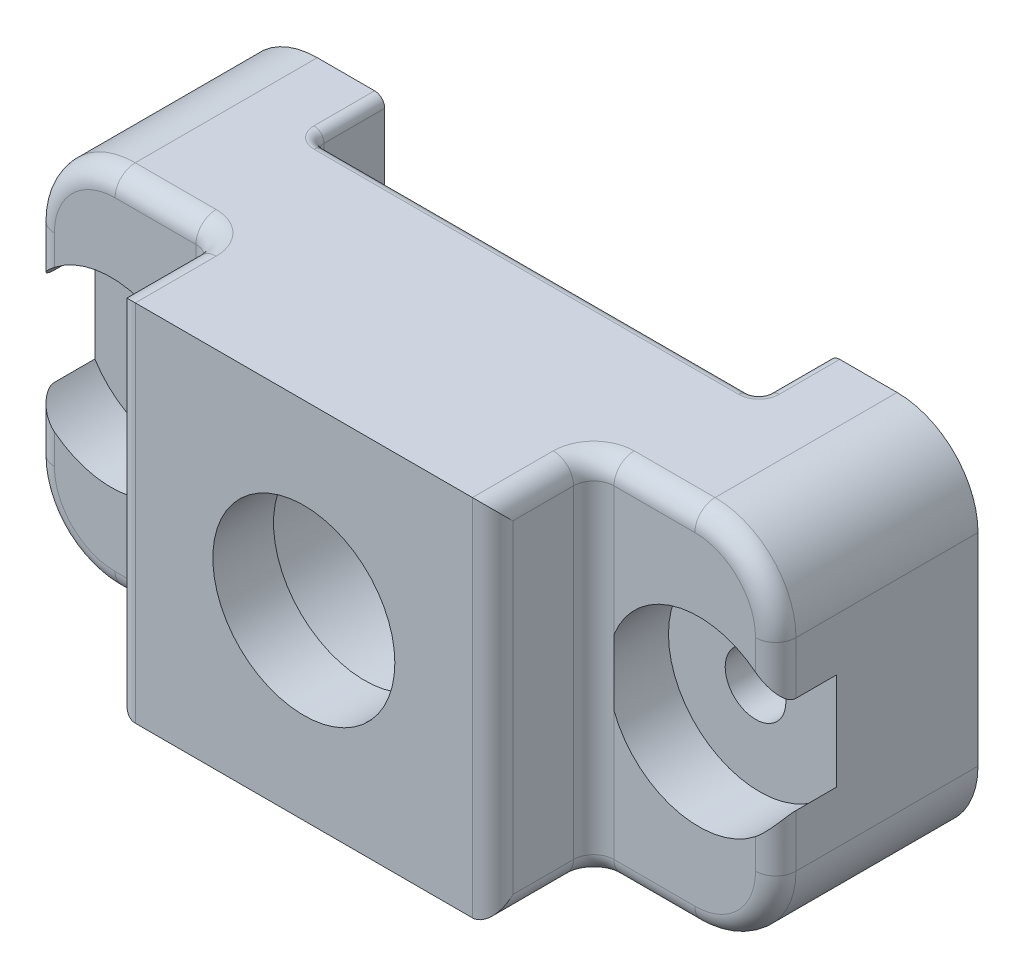
from build123d import *

# Parameters (mm, degrees)
SKETCH1_R            = 5.5
SKETCH1_R_2          = 1.5
BOSS_EXTRUDE1_DEPTH  = 15
SKETCH3_W            = 9.999397818
SKETCH3_H            = 22.225224056
CUT_EXTRUDE1_DEPTH   = 5
FILLET1_R            = 1
FILLET1_OF_MIRROR1_R = 1
SKETCH4_R            = 7.5
BOSS_EXTRUDE2_DEPTH  = 3
SKETCH5_W            = 22
SKETCH5_H            = 7
CUT_EXTRUDE2_DEPTH   = 30.75172255
SKETCH6_R            = 4.5
CUT_EXTRUDE3_DEPTH   = 26.34097462
SKETCH7_R            = 4.5
CUT_EXTRUDE8_DEPTH   = 3
FILLET3_R            = 0.5
FILLET2_R            = 0.5


with BuildPart() as part:
    # Sketch1 → Boss-Extrude1 (new body)
    with BuildSketch(Plane.XY):
        with BuildLine():
            Line((-14.334802826, 9), (14.334802826, 9))
            ThreePointArc((14.334802826, 9), (17.163229951, 7.828427125), (18.334802826, 5))
            Line((18.334802826, 5), (18.334802826, -5))
            ThreePointArc((18.334802826, -5), (17.163229951, -7.828427125), (14.334802826, -9))
            Line((14.334802826, -9), (-14.334802826, -9))
            ThreePointArc((-14.334802826, -9), (-17.163229951, -7.828427125), (-18.334802826, -5))
            Line((-18.334802826, -5), (-18.334802826, 5))
            ThreePointArc((-18.334802826, 5), (-17.163229951, 7.828427125), (-14.334802826, 9))
        make_face()
        Circle(SKETCH1_R, mode=Mode.SUBTRACT)
        with Locations((-14.334802826, 0)):
            Circle(SKETCH1_R_2, mode=Mode.SUBTRACT)
        with Locations(Location((14.334802826, 0, 0), (0, 0, 180))):
            Circle(SKETCH1_R_2, mode=Mode.SUBTRACT)
    extrude(amount=BOSS_EXTRUDE1_DEPTH)

    # Sketch3 → Cut-Extrude1 (cut)
    with BuildSketch(Plane.XY.offset(15)):
        with Locations((-14.334501735, -0.429661625)):
            Rectangle(SKETCH3_W, SKETCH3_H)
    cut_extrude1 = extrude(amount=-CUT_EXTRUDE1_DEPTH, mode=Mode.SUBTRACT)

    # Fillet1
    fillet1_edges = [part.edges().sort_by_distance(p)[0] for p in [
        (-9.334802826, -9, 12.5),
        (-9.334802826, 0, 10),
        (-9.334802826, 9, 12.5),
        (-17.163229951, 7.828427125, 10),
        (-11.834802826, 9, 10),
        (-11.834802826, -9, 10),
        (-17.163229951, -7.828427125, 10),
        (-18.334802826, 0, 10),
        (-9.334802826, 0, 15),
    ]]
    fillet(fillet1_edges, radius=FILLET1_R)

    # Mirror1: Cut-Extrude1 across plane
    add(cut_extrude1.mirror(Plane(origin=(0, 0, 0), x_dir=(0, 0, 1), z_dir=(1, 0, 0))), mode=Mode.SUBTRACT)

    # Fillet1 of Mirror1
    fillet1_of_mirror1_edges = [part.edges().sort_by_distance(p)[0] for p in [
        (9.334802826, -9, 12.5),
        (9.334802826, 0, 10),
        (9.334802826, 9, 12.5),
        (17.163229951, 7.828427125, 10),
        (11.834802826, 9, 10),
        (11.834802826, -9, 10),
        (17.163229951, -7.828427125, 10),
        (18.334802826, 0, 10),
        (9.334802826, 0, 15),
    ]]
    fillet(fillet1_of_mirror1_edges, radius=FILLET1_OF_MIRROR1_R)

    # Sketch4 → Boss-Extrude2 (add)
    with BuildSketch(Plane.XY.offset(15)):
        Circle(SKETCH4_R)
    extrude(amount=-BOSS_EXTRUDE2_DEPTH)

    # Sketch5 → Cut-Extrude2 (cut, through all)
    with BuildSketch(Plane(origin=(0, 9, 0), x_dir=(1, 0, 0), z_dir=(0, 1, 0))):
        Rectangle(SKETCH5_W, SKETCH5_H)
    extrude(amount=-CUT_EXTRUDE2_DEPTH, mode=Mode.SUBTRACT)

    # Sketch6 → Cut-Extrude3 (cut, through all)
    with BuildSketch(Plane.XY.offset(15)):
        Circle(SKETCH6_R)
    extrude(amount=-CUT_EXTRUDE3_DEPTH, mode=Mode.SUBTRACT)

    # Sketch7 → Cut-Extrude8 (cut)
    with BuildSketch(Plane.XY.offset(10)):
        with Locations((-14.530374954, 0)):
            Circle(SKETCH7_R)
        with Locations((14.530374954, 0)):
            Circle(SKETCH7_R)
    extrude(amount=-CUT_EXTRUDE8_DEPTH, mode=Mode.SUBTRACT)

    # Fillet3
    fillet3_edges = [part.edges().sort_by_distance(p)[0] for p in [
        (11, -9, 1.75),
        (0, -9, 3.5),
        (11, 0, 3.5),
        (-11, -9, 1.75),
        (-11, 0, 3.5),
        (-11, 9, 1.75),
        (0, 9, 3.5),
        (11, 9, 1.75),
    ]]
    fillet(fillet3_edges, radius=FILLET3_R)

    # Fillet2
    fillet2_edges = [part.edges().sort_by_distance(p)[0] for p in [
        (-5.5, 0, 12),
    ]]
    fillet(fillet2_edges, radius=FILLET2_R)


solid = part.part
